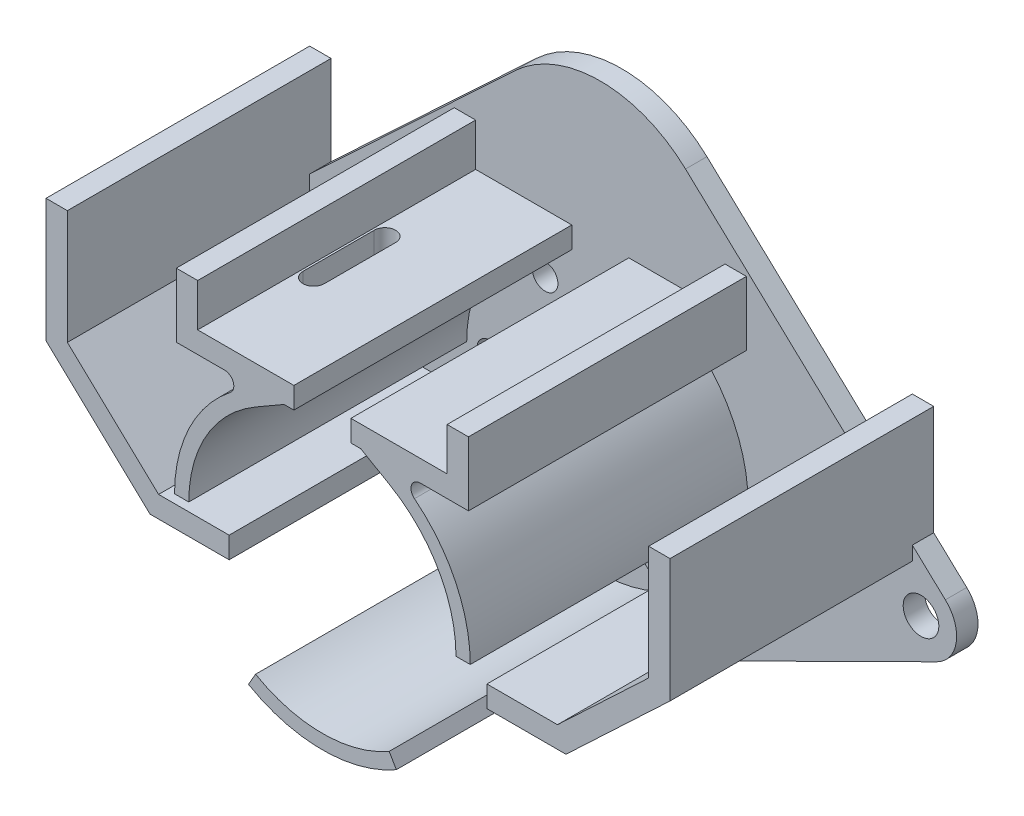
from build123d import *

# Parameters (mm, degrees)
SKETCH1_R           = 2.5
SKETCH1_R_2         = 6.5
SKETCH1_R_3         = 1.8
BOSS_EXTRUDE1_DEPTH = 3
BOSS_EXTRUDE2_DEPTH = 39
BOSS_EXTRUDE3_DEPTH = 39
CUT_EXTRUDE1_DEPTH  = 3
BOSS_EXTRUDE4_DEPTH = 34
BOSS_EXTRUDE5_DEPTH = 3


with BuildPart() as part:
    # Sketch1 → Boss-Extrude1 (new body)
    with BuildSketch(Plane.XY):
        with BuildLine():
            Line((-48.416861363, 3.650350453), (-11.959014769, 37.776226585))
            ThreePointArc((-11.959014769, 37.776226585), (0, 42.5), (11.959014769, 37.776226585))
            Line((11.959014769, 37.776226585), (48.416861363, 3.650350453))
            ThreePointArc((48.416861363, 3.650350453), (49.946989961, -0.726147591), (47.22369092, -4.478303104))
            Line((47.22369092, -4.478303104), (17.66776819, -19.154227328))
            ThreePointArc((17.66776819, -19.154227328), (16.856525691, -19.446371641), (16, -19.5455))
            Line((16, -19.5455), (-16, -19.5455))
            ThreePointArc((-16, -19.5455), (-16.856525691, -19.446371641), (-17.66776819, -19.154227328))
            Line((-17.66776819, -19.154227328), (-47.22369092, -4.478303104))
            ThreePointArc((-47.22369092, -4.478303104), (-49.946989961, -0.726147591), (-48.416861363, 3.650350453))
        make_face()
        with Locations((-25, 0)):
            Circle(SKETCH1_R, mode=Mode.SUBTRACT)
        with Locations((0, -5.5455)):
            Circle(SKETCH1_R_2, mode=Mode.SUBTRACT)
        with Locations((-7.75, 14.877893759)):
            Circle(SKETCH1_R_3, mode=Mode.SUBTRACT)
        with Locations((-15.5, 1.4545)):
            Circle(SKETCH1_R_3, mode=Mode.SUBTRACT)
        with Locations((-7.75, -11.968893759)):
            Circle(SKETCH1_R_3, mode=Mode.SUBTRACT)
        with Locations(Location((7.75, -11.968893759, 0), (0, 0, 180))):
            Circle(SKETCH1_R_3, mode=Mode.SUBTRACT)
        with Locations(Location((7.75, 14.877893759, 0), (0, 0, 180))):
            Circle(SKETCH1_R_3, mode=Mode.SUBTRACT)
        with Locations(Location((15.5, 1.4545, 0), (0, 0, 180))):
            Circle(SKETCH1_R_3, mode=Mode.SUBTRACT)
        with Locations(Location((25, 0, 0), (0, 0, 180))):
            Circle(SKETCH1_R, mode=Mode.SUBTRACT)
        with Locations((-45, 0)):
            Circle(SKETCH1_R, mode=Mode.SUBTRACT)
        with Locations(Location((45, 0, 0), (0, 0, 180))):
            Circle(SKETCH1_R, mode=Mode.SUBTRACT)
        with Locations((-16, -15.7955)):
            Circle(SKETCH1_R, mode=Mode.SUBTRACT)
        with Locations(Location((16, -15.7955, 0), (0, 0, 180))):
            Circle(SKETCH1_R, mode=Mode.SUBTRACT)
    extrude(amount=BOSS_EXTRUDE1_DEPTH)

    # Sketch2 → Boss-Extrude2 (add)
    with BuildSketch(Plane.XY.offset(3)):
        with BuildLine():
            Line((-20.75, 1.4545), (-18.75, 1.4545))
            ThreePointArc((-18.75, 1.4545), (-16.237976321, 10.8295), (-9.375, 17.692476321))
            Line((-9.375, 17.692476321), (-10.375, 19.424527129))
            ThreePointArc((-10.375, 19.424527129), (-17.970027129, 11.8295), (-20.75, 1.4545))
        make_face()
        with BuildLine():
            Line((-10.375, -16.515527129), (-9.375, -14.783476321))
            ThreePointArc((-9.375, -14.783476321), (0, -17.2955), (9.375, -14.783476321))
            Line((9.375, -14.783476321), (10.375, -16.515527129))
            ThreePointArc((10.375, -16.515527129), (0, -19.2955), (-10.375, -16.515527129))
        make_face()
        with BuildLine():
            ThreePointArc((18.75, 1.4545), (16.237976321, 10.8295), (9.375, 17.692476321))
            Line((9.375, 17.692476321), (10.375, 19.424527129))
            ThreePointArc((10.375, 19.424527129), (17.970027129, 11.8295), (20.75, 1.4545))
            Line((20.75, 1.4545), (18.75, 1.4545))
        make_face()
    extrude(amount=BOSS_EXTRUDE2_DEPTH)

    # Sketch3 → Boss-Extrude3 (add)
    with BuildSketch(Plane.XY.offset(3)):
        with BuildLine():
            Line((-17.5, 29), (-17.5, 23))
            Line((-17.5, 23), (-4, 23))
            Line((-4, 23), (-4, 20))
            Line((-4, 20), (-5.378251748, 20))
            Line((-5.378251748, 20), (-9.375, 17.692476321))
            Line((-9.375, 17.692476321), (-12.918615444, 17.692476321))
            ThreePointArc((-12.918615444, 17.692476321), (-12.502444344, 19.132335325), (-13.724553319, 20))
            Line((-13.724553319, 20), (-20.5, 20))
            Line((-20.5, 20), (-20.5, 29))
            Line((-20.5, 29), (-17.5, 29))
        make_face()
    boss_extrude3 = extrude(amount=BOSS_EXTRUDE3_DEPTH)

    # Mirror1: Boss-Extrude3 across plane
    add(boss_extrude3.mirror(Plane(origin=(0, 0, 0), x_dir=(0, 0, 1), z_dir=(1, 0, 0))))

    # Sketch4 → Cut-Extrude1 (cut)
    with BuildSketch(Plane(origin=(0, 23, 0), x_dir=(1, 0, 0), z_dir=(0, 1, 0))):
        with BuildLine():
            Line((-14.224553319, -17.5), (-14.224553319, -27.5))
            ThreePointArc((-14.224553319, -27.5), (-15.724553319, -29), (-17.224553319, -27.5))
            Line((-17.224553319, -27.5), (-17.224553319, -17.5))
            ThreePointArc((-17.224553319, -17.5), (-15.724553319, -16), (-14.224553319, -17.5))
        make_face()
        with BuildLine():
            Line((14.224553319, -17.5), (14.224553319, -27.5))
            ThreePointArc((14.224553319, -27.5), (15.724553319, -29), (17.224553319, -27.5))
            Line((17.224553319, -27.5), (17.224553319, -17.5))
            ThreePointArc((17.224553319, -17.5), (15.724553319, -16), (14.224553319, -17.5))
        make_face()
    extrude(amount=-CUT_EXTRUDE1_DEPTH, mode=Mode.SUBTRACT)

    # Sketch5 → Boss-Extrude4 (add)
    with BuildSketch(Plane.XY.offset(3)):
        Polygon((-43.784396435, 23.346849864), (-43.784396435, 6.040412882), (-29.176551712, -7.739510205), (-18.086117895, -7.739510205), (-18.086117895, -4.739510205), (-27.984845454, -4.739510205), (-40.784396435, 7.334606915), (-40.784396435, 23.346849864), align=None)
    boss_extrude4 = extrude(amount=BOSS_EXTRUDE4_DEPTH)

    # Mirror2: Boss-Extrude4 across plane
    add(boss_extrude4.mirror(Plane(origin=(0, 0, 0), x_dir=(0, 0, 1), z_dir=(1, 0, 0))))

    # Sketch6 → Boss-Extrude5 (add)
    with BuildSketch(Plane(origin=(0, 0, 3), x_dir=(-1, 0, 0), z_dir=(0, 0, -1))):
        Polygon((40.784396435, 23.346849864), (40.784396435, 10.794616422), (43.784396435, 7.986506839), (43.784396435, 23.346849864), align=None)
        Polygon((-43.784396435, 23.346849864), (-43.784396435, 7.986506839), (-40.784396435, 10.794616422), (-40.784396435, 23.346849864), align=None)
    extrude(amount=BOSS_EXTRUDE5_DEPTH)


solid = part.part
